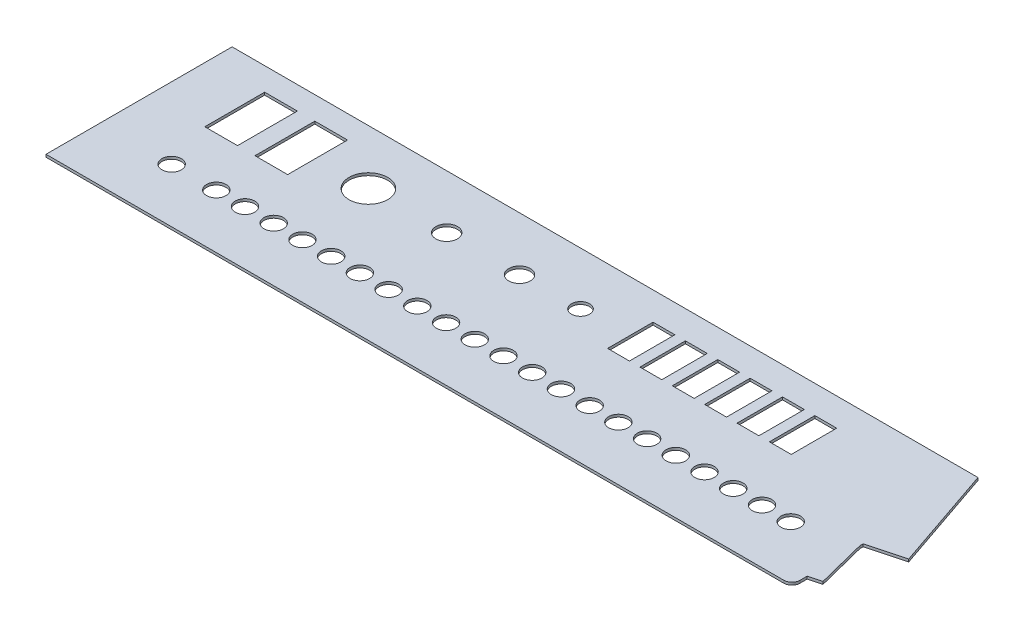
from build123d import *

# Parameters (mm, degrees)
SKETCH4_R           = 11.95
SKETCH4_R_2         = 6.65
SKETCH4_R_3         = 5.6
SKETCH4_R_4         = 6
SKETCH4_W           = 20.218579234
SKETCH4_H           = 37
SKETCH4_W_2         = 13.5
SKETCH4_H_2         = 28.1
BOSS_EXTRUDE3_DEPTH = 1.6


with BuildPart() as part:
    # Sketch4 → Boss-Extrude3 (new body)
    with BuildSketch(Plane(origin=(0, 0, 0), x_dir=(1, 0, 0), z_dir=(0, 1, 0))):
        with BuildLine():
            Line((-63.047420146, 63.390203379), (-63.047420146, -51.609796621))
            Line((-63.047420146, -51.609796621), (392.952579854, -51.609796621))
            ThreePointArc((392.952579854, -51.609796621), (396.48811376, -50.145330527), (397.952579854, -46.609796621))
            Line((397.952579854, -46.609796621), (397.952579854, -42.187494758))
            Line((397.952579854, -42.187494758), (405.679986464, -40.116942397))
            Line((405.679986464, -40.116942397), (397.952579854, -9.609796621))
            Line((397.952579854, -9.609796621), (397.952579854, -7.609796621))
            Line((397.952579854, -7.609796621), (420.168873859, -1.656958583))
            Line((420.168873859, -1.656958583), (397.952579854, 63.390203379))
            Line((397.952579854, 63.390203379), (-63.047420146, 63.390203379))
        make_face()
        with Locations(Location((54.9, 29.690203379, 0), (0, 0, 270))):
            Circle(SKETCH4_R, mode=Mode.SUBTRACT)
        with Locations(Location((102.75, 30.240203379, 0), (0, 0, 270))):
            Circle(SKETCH4_R_2, mode=Mode.SUBTRACT)
        with Locations(Location((147.75, 30.240203379, 0), (0, 0, 270))):
            Circle(SKETCH4_R_2, mode=Mode.SUBTRACT)
        with Locations(Location((184.9, 30.790203379, 0), (0, 0, 270))):
            Circle(SKETCH4_R_3, mode=Mode.SUBTRACT)
        with Locations(Location((-18.9, -18.109796621, 0), (0, 0, 270))):
            Circle(SKETCH4_R_4, mode=Mode.SUBTRACT)
        with Locations(Location((8.7, -18.109796621, 0), (0, 0, 270))):
            Circle(SKETCH4_R_4, mode=Mode.SUBTRACT)
        with Locations(Location((26.45, -18.109796621, 0), (0, 0, 270))):
            Circle(SKETCH4_R_4, mode=Mode.SUBTRACT)
        with Locations(Location((44.2, -18.109796621, 0), (0, 0, 270))):
            Circle(SKETCH4_R_4, mode=Mode.SUBTRACT)
        with Locations(Location((61.95, -18.109796621, 0), (0, 0, 270))):
            Circle(SKETCH4_R_4, mode=Mode.SUBTRACT)
        with Locations(Location((79.7, -18.109796621, 0), (0, 0, 270))):
            Circle(SKETCH4_R_4, mode=Mode.SUBTRACT)
        with Locations(Location((97.45, -18.109796621, 0), (0, 0, 270))):
            Circle(SKETCH4_R_4, mode=Mode.SUBTRACT)
        with Locations(Location((115.2, -18.109796621, 0), (0, 0, 270))):
            Circle(SKETCH4_R_4, mode=Mode.SUBTRACT)
        with Locations(Location((132.95, -18.109796621, 0), (0, 0, 270))):
            Circle(SKETCH4_R_4, mode=Mode.SUBTRACT)
        with Locations(Location((150.7, -18.109796621, 0), (0, 0, 270))):
            Circle(SKETCH4_R_4, mode=Mode.SUBTRACT)
        with Locations(Location((168.45, -18.109796621, 0), (0, 0, 270))):
            Circle(SKETCH4_R_4, mode=Mode.SUBTRACT)
        with Locations(Location((186.2, -18.109796621, 0), (0, 0, 270))):
            Circle(SKETCH4_R_4, mode=Mode.SUBTRACT)
        with Locations(Location((203.95, -18.109796621, 0), (0, 0, 270))):
            Circle(SKETCH4_R_4, mode=Mode.SUBTRACT)
        with Locations(Location((221.7, -18.109796621, 0), (0, 0, 270))):
            Circle(SKETCH4_R_4, mode=Mode.SUBTRACT)
        with Locations(Location((239.45, -18.109796621, 0), (0, 0, 270))):
            Circle(SKETCH4_R_4, mode=Mode.SUBTRACT)
        with Locations(Location((257.2, -18.109796621, 0), (0, 0, 270))):
            Circle(SKETCH4_R_4, mode=Mode.SUBTRACT)
        with Locations(Location((274.95, -18.109796621, 0), (0, 0, 270))):
            Circle(SKETCH4_R_4, mode=Mode.SUBTRACT)
        with Locations(Location((292.7, -18.109796621, 0), (0, 0, 270))):
            Circle(SKETCH4_R_4, mode=Mode.SUBTRACT)
        with Locations(Location((310.45, -18.109796621, 0), (0, 0, 270))):
            Circle(SKETCH4_R_4, mode=Mode.SUBTRACT)
        with Locations(Location((328.2, -18.109796621, 0), (0, 0, 270))):
            Circle(SKETCH4_R_4, mode=Mode.SUBTRACT)
        with Locations(Location((345.95, -18.109796621, 0), (0, 0, 270))):
            Circle(SKETCH4_R_4, mode=Mode.SUBTRACT)
        with Locations(Location((363.7, -18.109796621, 0), (0, 0, 270))):
            Circle(SKETCH4_R_4, mode=Mode.SUBTRACT)
        with Locations((-18.6, 30.690203379)):
            Rectangle(SKETCH4_W, SKETCH4_H, mode=Mode.SUBTRACT)
        with Locations((12.4, 30.690203379)):
            Rectangle(SKETCH4_W, SKETCH4_H, mode=Mode.SUBTRACT)
        with Locations((241.15, 32.073143277)):
            Rectangle(SKETCH4_W_2, SKETCH4_H_2, mode=Mode.SUBTRACT)
        with Locations((221.15, 32.073143277)):
            Rectangle(SKETCH4_W_2, SKETCH4_H_2, mode=Mode.SUBTRACT)
        with Locations((261.15, 32.073143277)):
            Rectangle(SKETCH4_W_2, SKETCH4_H_2, mode=Mode.SUBTRACT)
        with Locations((281.15, 32.073143277)):
            Rectangle(SKETCH4_W_2, SKETCH4_H_2, mode=Mode.SUBTRACT)
        with Locations((301.15, 32.073143277)):
            Rectangle(SKETCH4_W_2, SKETCH4_H_2, mode=Mode.SUBTRACT)
        with Locations((321.15, 32.073143277)):
            Rectangle(SKETCH4_W_2, SKETCH4_H_2, mode=Mode.SUBTRACT)
    extrude(amount=BOSS_EXTRUDE3_DEPTH)


solid = part.part
